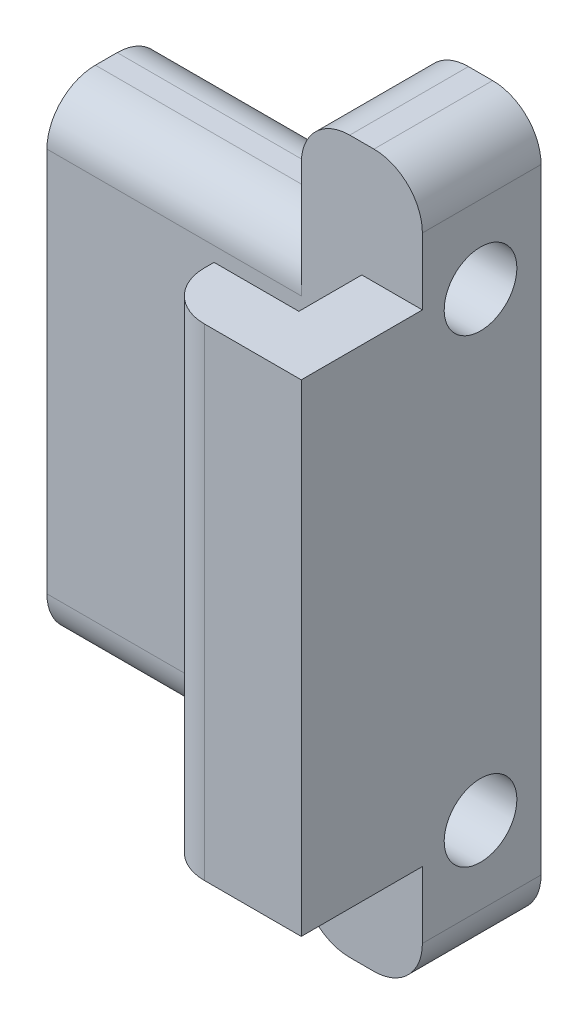
from build123d import *

# Parameters (mm, degrees)
EXTRUDE_1_DEPTH     = 4.9
FILLET_1_R          = 2
SKETCH_3_R          = 1.5
CUT_EXTRUDE_1_DEPTH = 3
SKETCH_4_W          = 5
SKETCH_4_H          = 19.9
EXTRUDE_2_DEPTH     = 5
SKETCH_5_W          = 2.5
SKETCH_5_H          = 2.6
CUT_EXTRUDE_2_DEPTH = 31.755202812
FILLET_3_R          = 2
SKETCH_6_W          = 2.4
SKETCH_6_H          = 19.9
EXTRUDE_3_DEPTH     = 1
FILLET_4_R          = 2


with BuildPart() as part:
    # 草图2 → 凸台-拉伸1 (new body)
    with BuildSketch(Plane.XY):
        Polygon((0, 0), (0, 19.9), (10.5, 19.9), (10.5, 24.65), (15.5, 24.65), (15.5, -4.75), (10.5, -4.75), (10.5, 0), align=None)
    extrude(amount=EXTRUDE_1_DEPTH)

    # 圆角1
    fillet_1_edges = [part.edges().sort_by_distance(p)[0] for p in [
        (5.25, 0, 0),
        (5.25, 19.9, 4.9),
        (5.25, 0, 4.9),
        (5.25, 19.9, 0),
    ]]
    fillet(fillet_1_edges, radius=FILLET_1_R)

    # 草图3 → 切除-拉伸1 (cut)
    with BuildSketch(Plane(origin=(15.5, 0, 0), x_dir=(0, 0, -1), z_dir=(1, 0, 0))):
        with Locations(Location((-2.5, 19.45, 0), (0, 0, 90))):
            Circle(SKETCH_3_R)
        with Locations(Location((-2.5, 0.45, 0), (0, 0, 270))):
            Circle(SKETCH_3_R)
    extrude(amount=-CUT_EXTRUDE_1_DEPTH, mode=Mode.SUBTRACT)

    # 草图4 → 凸台-拉伸2 (add)
    with BuildSketch(Plane.XY.offset(4.9)):
        with Locations((13, 9.95)):
            Rectangle(SKETCH_4_W, SKETCH_4_H)
    extrude(amount=EXTRUDE_2_DEPTH)

    # 草图5 → 切除-拉伸2 (cut, through all)
    with BuildSketch(Plane(origin=(0, 19.9, 0), x_dir=(1, 0, 0), z_dir=(0, 1, 0))):
        with Locations((11.75, -6.2)):
            Rectangle(SKETCH_5_W, SKETCH_5_H)
    extrude(amount=-CUT_EXTRUDE_2_DEPTH, mode=Mode.SUBTRACT)

    # 圆角3
    fillet_3_edges = [part.edges().sort_by_distance(p)[0] for p in [
        (10.5, 24.65, 2.45),
        (15.5, 24.65, 2.45),
        (15.5, -4.75, 2.45),
        (10.5, -4.75, 2.45),
    ]]
    fillet(fillet_3_edges, radius=FILLET_3_R)

    # 草图6 → 凸台-拉伸3 (add)
    with BuildSketch(Plane.ZY.offset(-10.5)):
        with Locations((8.7, 9.95)):
            Rectangle(SKETCH_6_W, SKETCH_6_H)
    extrude(amount=EXTRUDE_3_DEPTH)

    # 圆角4
    fillet_4_edges = [part.edges().sort_by_distance(p)[0] for p in [
        (9.5, 9.95, 9.9),
    ]]
    fillet(fillet_4_edges, radius=FILLET_4_R)


solid = part.part
